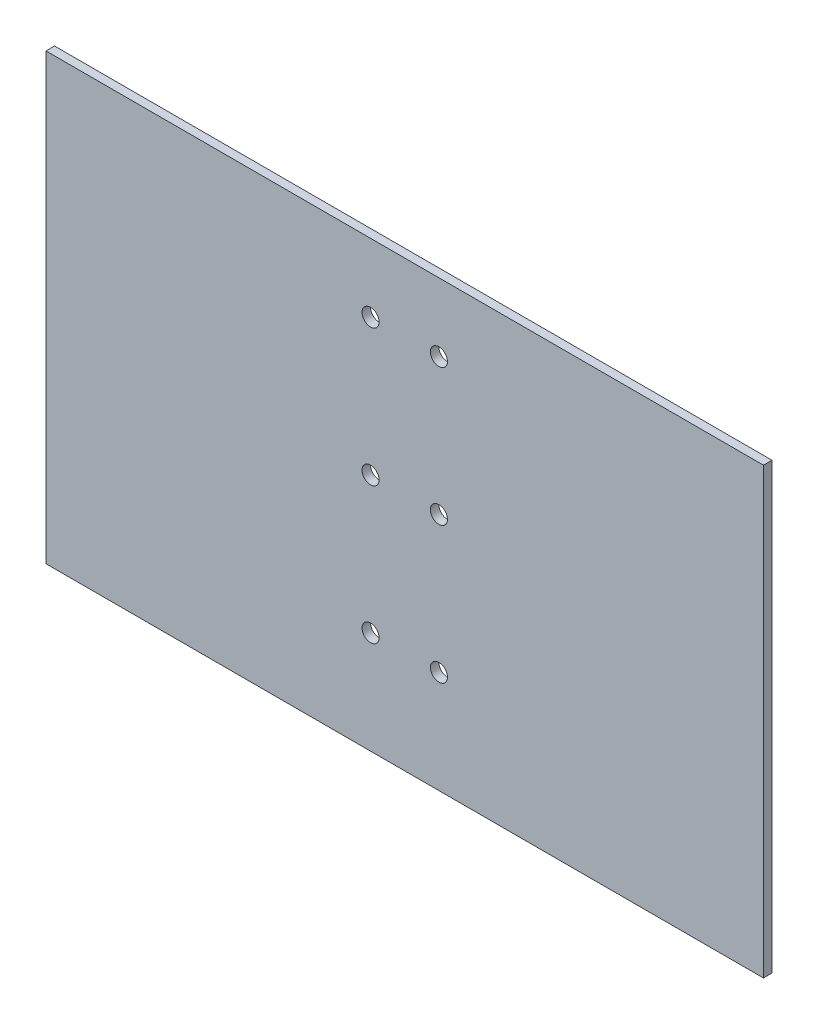
from build123d import *

# Parameters (mm, degrees)
SKETCH1_W           = 254
SKETCH1_H           = 152.4
SKETCH1_R           = 53.34
BOSS_EXTRUDE1_DEPTH = 6.35
BOSS_EXTRUDE2_START = -6.35
SKETCH13_R          = 53.34
BOSS_EXTRUDE2_DEPTH = 6.35
SKETCH21_W          = 431.8
SKETCH21_H          = 279.4
SKETCH21_W_2        = 254
SKETCH21_H_2        = 152.4
BOSS_EXTRUDE5_DEPTH = 6.35
SKETCH19_R          = 6.35
CUT_EXTRUDE5_DEPTH  = 265.346160366
SKETCH25_W          = 533.4
SKETCH25_H          = 330.2
SKETCH25_W_2        = 431.8
SKETCH25_H_2        = 279.4
BOSS_EXTRUDE7_DEPTH = 6.35


with BuildPart() as part:
    # Sketch1 → Boss-Extrude1 (new body)
    with BuildSketch(Plane.XY):
        Rectangle(SKETCH1_W, SKETCH1_H)
        Circle(SKETCH1_R, mode=Mode.SUBTRACT)
    extrude(amount=BOSS_EXTRUDE1_DEPTH)

    # Sketch13 → Boss-Extrude2 (add)
    with BuildSketch(Plane.XY.offset(6.35).offset(BOSS_EXTRUDE2_START)):
        Circle(SKETCH13_R)
    extrude(amount=BOSS_EXTRUDE2_DEPTH)

    # Sketch21 → Boss-Extrude5 (add)
    with BuildSketch(Plane.XY.offset(6.35)):
        with Locations((0, 12.7)):
            Rectangle(SKETCH21_W, SKETCH21_H)
        Rectangle(SKETCH21_W_2, SKETCH21_H_2, mode=Mode.SUBTRACT)
    extrude(amount=-BOSS_EXTRUDE5_DEPTH)

    # Sketch19 → Cut-Extrude5 (cut, through all)
    with BuildSketch(Plane.XY.offset(6.35)):
        with Locations((-25.4, 127)):
            Circle(SKETCH19_R)
        with Locations((-25.4, 25.4)):
            Circle(SKETCH19_R)
        with Locations(Location((25.4, 25.4, 0), (0, 0, 180))):
            Circle(SKETCH19_R)
        with Locations(Location((25.4, 127, 0), (0, 0, 180))):
            Circle(SKETCH19_R)
        with Locations((-25.4, -76.2)):
            Circle(SKETCH19_R)
        with Locations(Location((25.4, -76.2, 0), (0, 0, 180))):
            Circle(SKETCH19_R)
    extrude(amount=-CUT_EXTRUDE5_DEPTH, mode=Mode.SUBTRACT)

    # Sketch25 → Boss-Extrude7 (add)
    with BuildSketch(Plane.XY.offset(6.35)):
        with Locations((0, 12.7)):
            Rectangle(SKETCH25_W, SKETCH25_H)
        with Locations((0, 12.7)):
            Rectangle(SKETCH25_W_2, SKETCH25_H_2, mode=Mode.SUBTRACT)
    extrude(amount=-BOSS_EXTRUDE7_DEPTH)


solid = part.part
